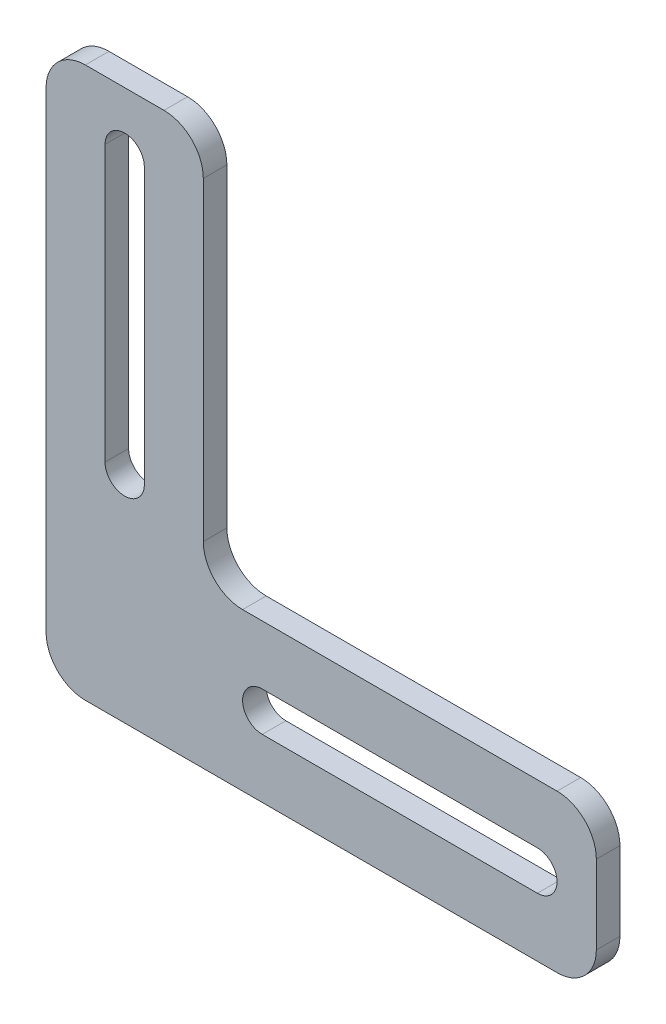
from build123d import *

# Parameters (mm, degrees)
BOSS_EXTRUDE1_DEPTH = 3
FILLET1_R           = 5


with BuildPart() as part:
    # Sketch1 → Boss-Extrude1 (new body)
    with BuildSketch(Plane.XY):
        Polygon((0, 70), (0, 0), (70, 0), (70, 20), (20, 20), (20, 70), align=None)
        with BuildLine():
            Line((12.5, 62.5), (12.5, 27.5))
            ThreePointArc((12.5, 27.5), (10, 25), (7.5, 27.5))
            Line((7.5, 27.5), (7.5, 62.5))
            ThreePointArc((7.5, 62.5), (10, 65), (12.5, 62.5))
        make_face(mode=Mode.SUBTRACT)
        with BuildLine():
            Line((62.5, 7.5), (27.5, 7.5))
            ThreePointArc((27.5, 7.5), (25, 10), (27.5, 12.5))
            Line((27.5, 12.5), (62.5, 12.5))
            ThreePointArc((62.5, 12.5), (65, 10), (62.5, 7.5))
        make_face(mode=Mode.SUBTRACT)
    extrude(amount=BOSS_EXTRUDE1_DEPTH)

    # Fillet1
    fillet1_edges = [part.edges().sort_by_distance(p)[0] for p in [
        (20, 20, 1.5),
        (70, 0, 1.5),
        (70, 20, 1.5),
        (0, 0, 1.5),
        (0, 70, 1.5),
        (20, 70, 1.5),
    ]]
    fillet(fillet1_edges, radius=FILLET1_R)


solid = part.part
